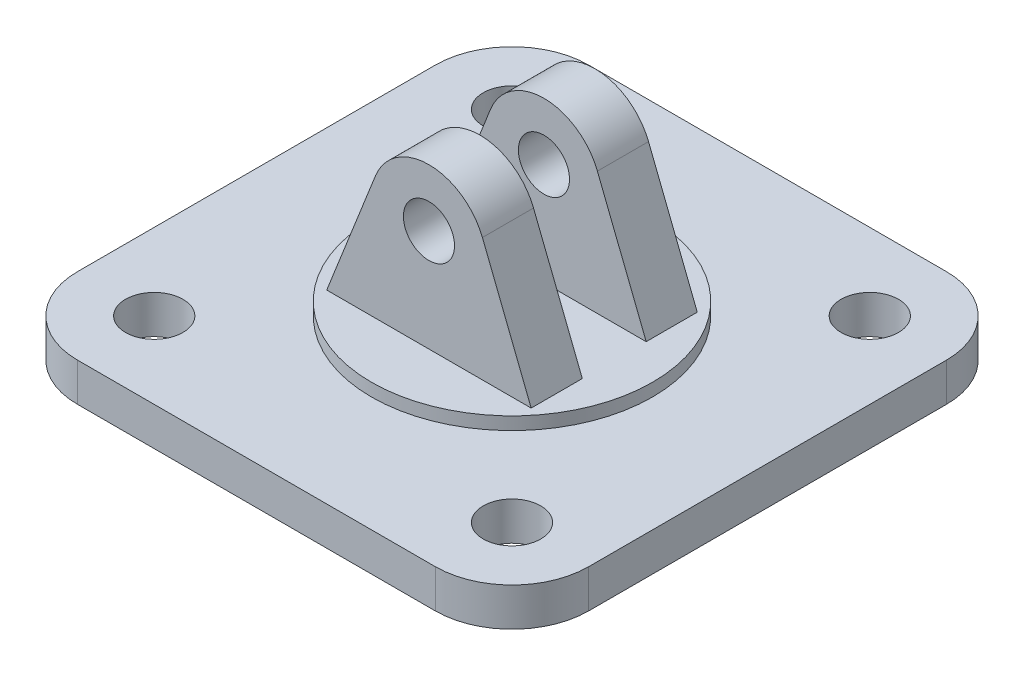
from build123d import *

# Parameters (mm, degrees)
SKETCH1_W           = 100
SKETCH1_H           = 100
BOSS_EXTRUDE1_DEPTH = 7.5
FILLET1_R           = 15
SKETCH2_R           = 5.625
CUT_EXTRUDE1_DEPTH  = 7.5
SKETCH3_R           = 27.5
BOSS_EXTRUDE2_DEPTH = 2.5
SKETCH5_W           = 40
SKETCH5_H           = 10
BOSS_EXTRUDE4_DEPTH = 40
SKETCH6_R           = 5
CUT_EXTRUDE2_DEPTH  = 10
CUT_EXTRUDE3_DEPTH  = 1.875


with BuildPart() as part:
    # Sketch1 → Boss-Extrude1 (new body)
    with BuildSketch(Plane(origin=(0, 0, 0), x_dir=(1, 0, 0), z_dir=(0, 1, 0))):
        Rectangle(SKETCH1_W, SKETCH1_H)
    extrude(amount=BOSS_EXTRUDE1_DEPTH)

    # Fillet1
    fillet1_edges = [part.edges().sort_by_distance(p)[0] for p in [
        (50, 3.75, 50),
        (-50, 3.75, 50),
        (-50, 3.75, -50),
        (50, 3.75, -50),
    ]]
    fillet(fillet1_edges, radius=FILLET1_R)

    # Sketch2 → Cut-Extrude1 (cut)
    with BuildSketch(Plane(origin=(0, 7.5, 0), x_dir=(1, 0, 0), z_dir=(0, 1, 0))):
        with Locations(Location((-35, 35, 0), (0, 0, 270))):
            Circle(SKETCH2_R)
        with Locations(Location((35, 35, 0), (0, 0, 90))):
            Circle(SKETCH2_R)
        with Locations(Location((35, -35, 0), (0, 0, 270))):
            Circle(SKETCH2_R)
        with Locations(Location((-35, -35, 0), (0, 0, 90))):
            Circle(SKETCH2_R)
    extrude(amount=-CUT_EXTRUDE1_DEPTH, mode=Mode.SUBTRACT)

    # Sketch3 → Boss-Extrude2 (add)
    with BuildSketch(Plane(origin=(0, 7.5, 0), x_dir=(1, 0, 0), z_dir=(0, 1, 0))):
        with Locations(Location((0, 0, 0), (0, 0, 270))):
            Circle(SKETCH3_R)
    extrude(amount=BOSS_EXTRUDE2_DEPTH)

    # Sketch5 → Boss-Extrude4 (add)
    with BuildSketch(Plane(origin=(0, 10, 0), x_dir=(1, 0, 0), z_dir=(0, 1, 0))):
        with Locations((0, -11.25)):
            Rectangle(SKETCH5_W, SKETCH5_H)
    boss_extrude4 = extrude(amount=BOSS_EXTRUDE4_DEPTH)

    # Sketch6 → Cut-Extrude2 (cut)
    with BuildSketch(Plane.XY.offset(16.25)):
        with BuildLine():
            ThreePointArc((10.462689665, 34.134564665), (0, 41.25), (-10.462689665, 34.134564665))
            Line((-10.462689665, 34.134564665), (-20, 10))
            Line((-20, 10), (-20, 50))
            Line((-20, 50), (20, 50))
            Line((20, 50), (20, 10))
            Line((20, 10), (10.462689665, 34.134564665))
        make_face()
        with Locations((0, 30)):
            Circle(SKETCH6_R)
    cut_extrude2 = extrude(amount=-CUT_EXTRUDE2_DEPTH, mode=Mode.SUBTRACT)

    # Mirror4: Boss-Extrude4, Cut-Extrude2 across plane
    add(boss_extrude4.mirror(Plane.XY))
    add(cut_extrude2.mirror(Plane.XY), mode=Mode.SUBTRACT)

    # Sketch7 → Cut-Extrude3 (cut)
    with BuildSketch(Plane.XZ):
        with BuildLine():
            Line((-20, -25), (20, -25))
            ThreePointArc((20, -25), (23.535533906, -23.535533906), (25, -20))
            Line((25, -20), (25, 20))
            ThreePointArc((25, 20), (23.535533906, 23.535533906), (20, 25))
            Line((20, 25), (-20, 25))
            ThreePointArc((-20, 25), (-23.535533906, 23.535533906), (-25, 20))
            Line((-25, 20), (-25, -20))
            ThreePointArc((-25, -20), (-23.535533906, -23.535533906), (-20, -25))
        make_face()
    extrude(amount=-CUT_EXTRUDE3_DEPTH, mode=Mode.SUBTRACT)


solid = part.part
